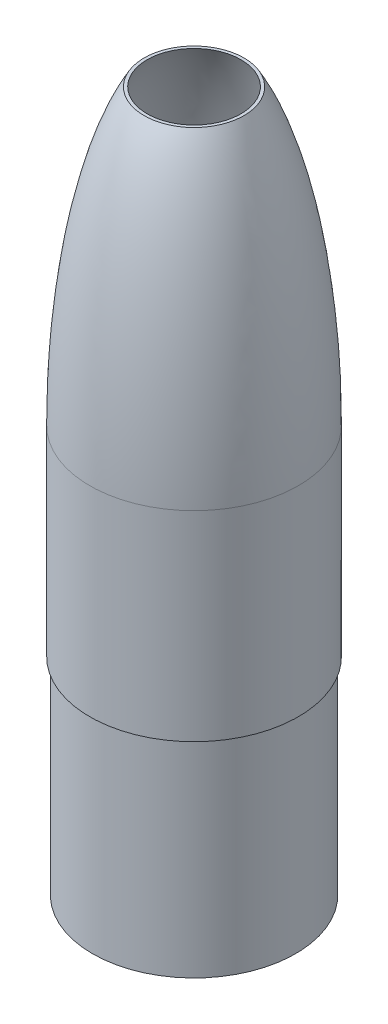
from build123d import *

# Parameters (mm, degrees)
BOSS_EXTRUDE1_START = -304.8
SKETCH2_R           = 76.2
SKETCH2_R_2         = 74.2
BOSS_EXTRUDE1_DEPTH = 304.8
SKETCH3_R           = 102.13398709
CUT_EXTRUDE1_DEPTH  = 30


with BuildPart() as part:
    # Sketch1 → Revolve1 (revolve)
    with BuildSketch(Plane.XY, mode=Mode.PRIVATE) as revolve1_sk:
        with BuildLine():
            Line((76.2, 150), (76.2, 0))
            Line((76.2, 0), (78.16, 0))
            Line((78.16, 0), (78.16, 150))
            add(Edge.make_bspline(
                [(0, 400), (2.723149784, 400), (8.095363208, 399.131102803), (15.985209364, 395.313409978), (23.550682528, 389.130576689), (33.207143777, 377.875372886), (44.403572502, 358.368758892), (56.109342912, 327.087146412), (65.689764926, 289.080732548), (71.61438571, 252.993821619), (74.98797824, 222.299614595), (76.812690029, 198.58573428), (77.914396428, 174.415956203), (78.16, 158.124741441), (78.16, 150)],
                knots=[-1.570796327, -1.570796327, -1.570796327, -1.570796327, -1.472621556, -1.374446786, -1.276272016, -1.178097245, -0.981747704, -0.785398163, -0.589048623, -0.392699082, -0.294524311, -0.196349541, -0.09817477, 0, 0, 0, 0], degree=3))
            Line((0, 400), (0, 398.04))
            add(Edge.make_bspline(
                [(76.2, 150), (76.2, 398.04), (0, 398.04)],
                knots=[4.71238898, 4.71238898, 4.71238898, 6.283185307, 6.283185307, 6.283185307], degree=2, weights=[1, 0.707106781, 1]))
        make_face()
    revolve(revolve1_sk.sketch.rotate(Axis((0, 0, 0), (0, 1, 0)), 90), axis=Axis((0, 0, 0), (0, 1, 0)))

    # Sketch2 → Boss-Extrude1 (add)
    with BuildSketch(Plane(origin=(0, 150, 0), x_dir=(1, 0, 0), z_dir=(0, 1, 0)).offset(BOSS_EXTRUDE1_START)):
        with Locations(Location((0, 0, 0), (0, 0, 270))):
            Circle(SKETCH2_R)
        with Locations(Location((0, 0, 0), (0, 0, 270))):
            Circle(SKETCH2_R_2, mode=Mode.SUBTRACT)
    extrude(amount=BOSS_EXTRUDE1_DEPTH)

    # Sketch3 → Cut-Extrude1 (cut)
    with BuildSketch(Plane(origin=(0, 400, 0), x_dir=(-1, 0, 0), z_dir=(0, -1, 0))):
        Circle(SKETCH3_R)
    extrude(amount=CUT_EXTRUDE1_DEPTH, mode=Mode.SUBTRACT)


solid = part.part
